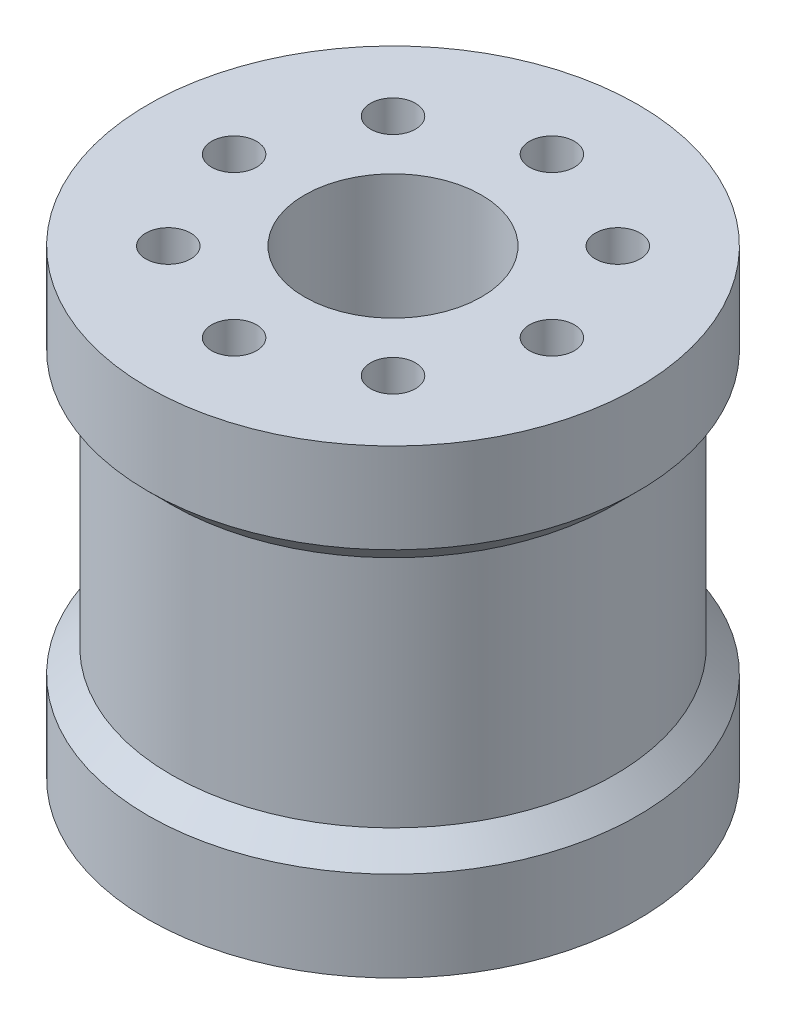
from build123d import *

# Parameters (mm, degrees)
SKETCH2_R          = 3.935
SKETCH2_R_2        = 1
CUT_EXTRUDE1_DEPTH = 45


with BuildPart() as part:
    # Sketch1 → Revolve1 (revolve)
    with BuildSketch(Plane.XY, mode=Mode.PRIVATE) as revolve1_sk:
        Polygon((-3, 0), (-3, 20.5), (-10.9, 20.5), (-10.9, 16.5), (-9.855, 15.455), (-9.855, 5.045), (-10.9, 4), (-10.9, 0), align=None)
    revolve(revolve1_sk.sketch.rotate(Axis((0, 0, 0), (0, 1, 0)), 270), axis=Axis((0, 0, 0), (0, 1, 0)))

    # Sketch2 → Cut-Extrude1 (cut)
    with BuildSketch(Plane(origin=(0, 20.5, 0), x_dir=(1, 0, 0), z_dir=(0, 1, 0))):
        with Locations(Location((0, 0, 0), (0, 0, 270))):
            Circle(SKETCH2_R)
        with Locations(Location((-5, 5, 0), (0, 0, 270))):
            Circle(SKETCH2_R_2)
        with Locations(Location((5, 5, 0), (0, 0, 270))):
            Circle(SKETCH2_R_2)
        with Locations(Location((5, -5, 0), (0, 0, 270))):
            Circle(SKETCH2_R_2)
        with Locations(Location((-5, -5, 0), (0, 0, 270))):
            Circle(SKETCH2_R_2)
        with Locations(Location((-7.071067812, 0, 0), (0, 0, 270))):
            Circle(SKETCH2_R_2)
        with Locations(Location((0, 7.071067812, 0), (0, 0, 270))):
            Circle(SKETCH2_R_2)
        with Locations(Location((7.071067812, 0, 0), (0, 0, 270))):
            Circle(SKETCH2_R_2)
        with Locations(Location((0, -7.071067812, 0), (0, 0, 270))):
            Circle(SKETCH2_R_2)
    extrude(amount=-CUT_EXTRUDE1_DEPTH, mode=Mode.SUBTRACT)


solid = part.part
